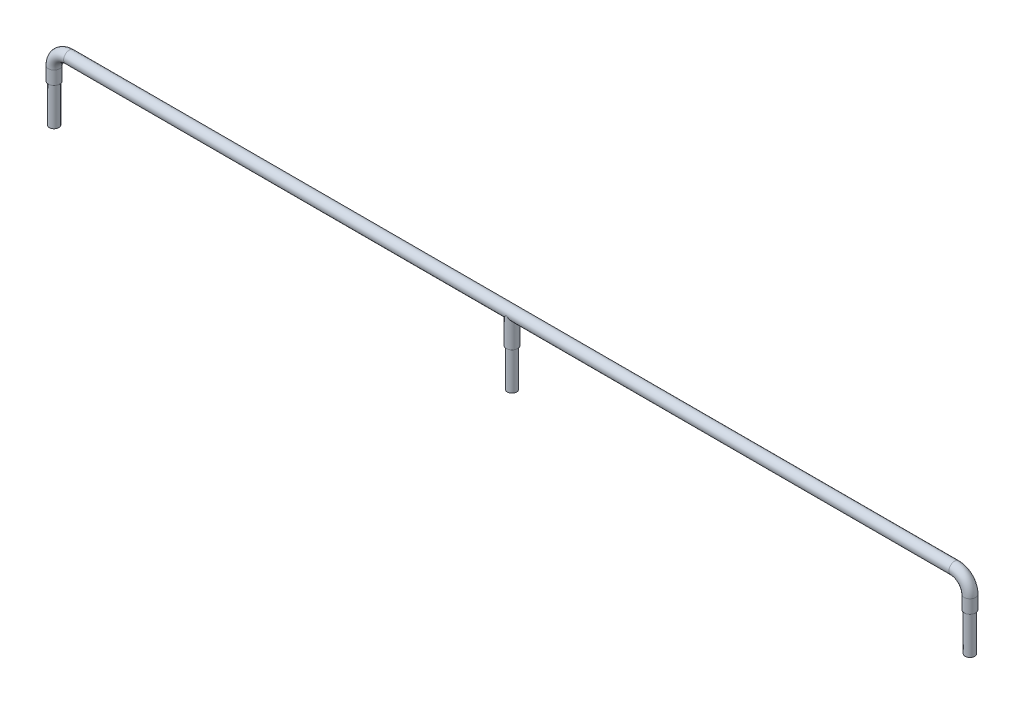
from build123d import *

# Parameters (mm, degrees)
SWEEP_1_PROFILE_R    = 30
SWEEP_1_PROFILE_R_2  = 20
EXTRUDE_1_REACH      = 2461.715
EXTRUDE_1_END_RADIUS = 30
SKETCH_78_R          = 30
SKETCH_78_R_2        = 20
SKETCH_79_R          = 30
SKETCH_79_R_2        = 25
CUT_EXTRUDE_1_DEPTH  = 200


with BuildPart() as part:
    # 扫描-薄件1: sweep along a path in 草图1
    with BuildLine(Plane.XY) as sweep_1_path:
        Line((-2400, 0), (-2400, 270))
        ThreePointArc((-2400, 270), (-2376.568542495, 326.568542495), (-2320, 350))
        Line((-2320, 350), (2320, 350))
        ThreePointArc((2320, 350), (2376.568542495, 326.568542495), (2400, 270))
        Line((2400, 270), (2400, 0))
    # 扫描-薄件1 profile (on start of the path) → 扫描-薄件1 (sweep)
    with BuildSketch(Plane(origin=(-2400, 0, 0), x_dir=(0, 0, 1), z_dir=(0, 1, 0))):
        Circle(SWEEP_1_PROFILE_R)
        Circle(SWEEP_1_PROFILE_R_2, mode=Mode.SUBTRACT)
    sweep(path=sweep_1_path.line)

    # 凸台-拉伸1: up to this cylinder (the profile starts outside it)
    extrude_1_end = Plane(origin=(-29.151472, 350, 0), z_dir=(1, 0, 0)) * Cylinder(EXTRUDE_1_END_RADIUS, 4984.43, mode=Mode.PRIVATE)
    # 草图78 → 凸台-拉伸1 (add, up to the surface)
    with BuildSketch(Plane.XZ, mode=Mode.PRIVATE) as extrude_1_sk1:
        Circle(SKETCH_78_R)
        Circle(SKETCH_78_R_2, mode=Mode.SUBTRACT)
    extrude_1_tool1 = extrude(extrude_1_sk1.sketch, amount=-EXTRUDE_1_REACH, mode=Mode.PRIVATE) - extrude_1_end
    add(extrude_1_tool1.solids().sort_by_distance((-29.151472, 0, 0))[0])

    # 草图79 → 切除-拉伸1 (cut)
    # profile 1 of 3: a face of its own
    with BuildSketch(Plane.XZ):
        with Locations((-2400, 0)):
            Circle(SKETCH_79_R)
        with Locations((-2400, 0)):
            Circle(SKETCH_79_R_2, mode=Mode.SUBTRACT)
    # profile 2 of 3: a face of its own
    with BuildSketch(Plane.XZ):
        Circle(SKETCH_79_R)
        Circle(SKETCH_79_R_2, mode=Mode.SUBTRACT)
    # profile 3 of 3: a face of its own
    with BuildSketch(Plane.XZ):
        with Locations((2400, 0)):
            Circle(SKETCH_79_R)
        with Locations((2400, 0)):
            Circle(SKETCH_79_R_2, mode=Mode.SUBTRACT)
    extrude(amount=-CUT_EXTRUDE_1_DEPTH, mode=Mode.SUBTRACT)


solid = part.part
